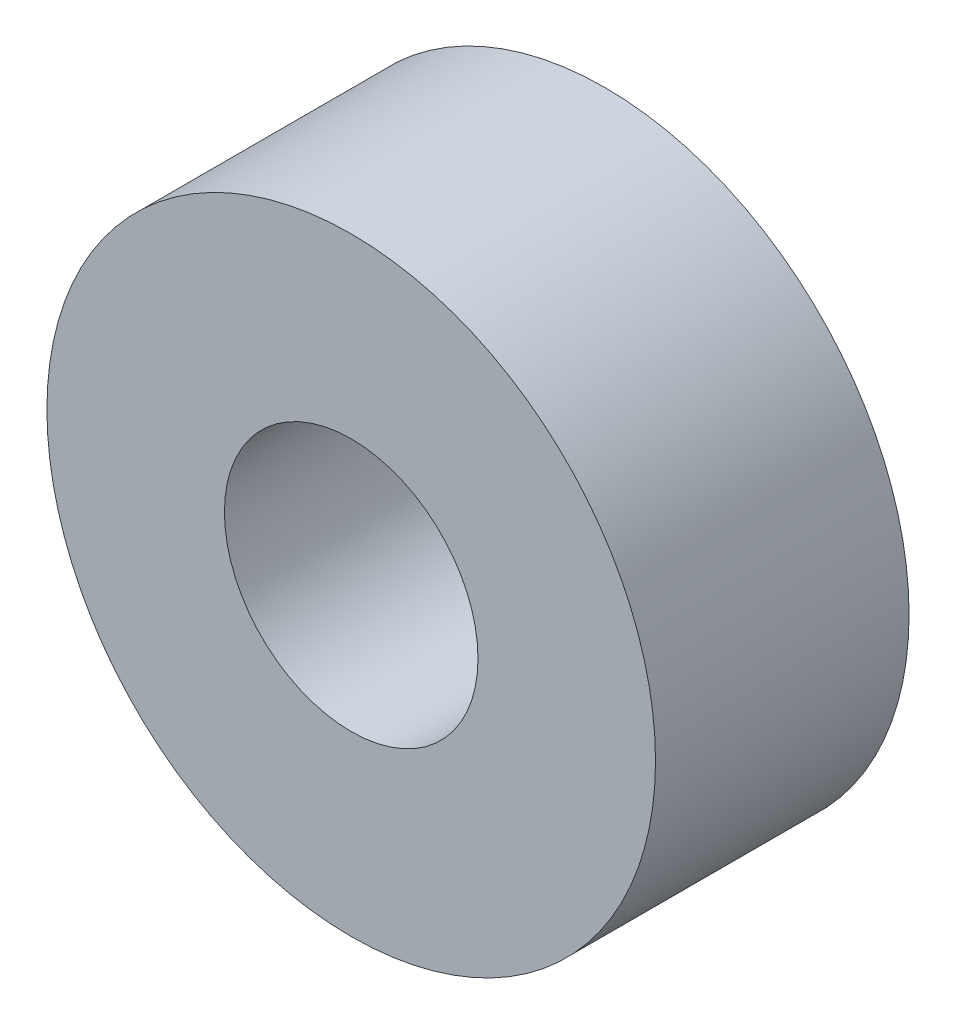
from build123d import *

# Parameters (mm, degrees)
SKETCH_1_R      = 12
SKETCH_1_R_2    = 5
EXTRUDE_1_DEPTH = 5


with BuildPart() as part:
    # 草图1 → 凸台-拉伸1 (new, symmetric)
    with BuildSketch(Plane.XY):
        Circle(SKETCH_1_R)
        Circle(SKETCH_1_R_2, mode=Mode.SUBTRACT)
    extrude(amount=EXTRUDE_1_DEPTH, both=True)


solid = part.part
